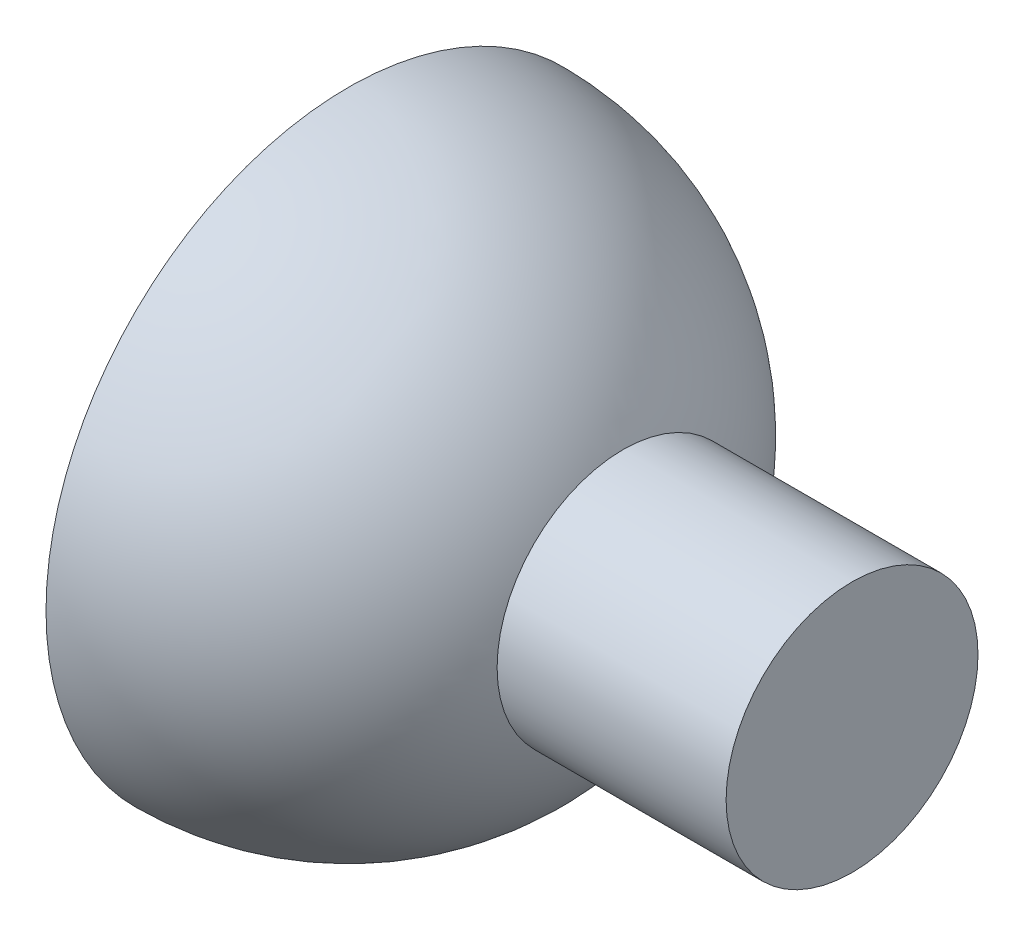
from build123d import *

# Parameters (mm, degrees)
BOSS_EXTRUDE2_START             = -15
SKETCH4_R                       = 5
BOSS_EXTRUDE2_DEPTH             = 5
BOSS_EXTRUDE2_DIRECTION_2_REACH = 37.785


with BuildPart() as part:
    # Sketch3 → Revolve-Thin2 (revolve)
    with BuildSketch(Plane.XY):
        with BuildLine():
            ThreePointArc((10, 0), (7.071067812, 7.071067812), (0, 10))
            Line((0, 10), (0, 12))
            ThreePointArc((0, 12), (8.485281374, 8.485281374), (12, 0))
            Line((12, 0), (10, 0))
        make_face()
    revolve(axis=Axis((0, 0, 0), (1, 0, 0)))

    # Sketch4 → Boss-Extrude2 (add)
    with BuildSketch(Plane.ZY.offset(BOSS_EXTRUDE2_START)):
        Circle(SKETCH4_R)
    extrude(amount=-BOSS_EXTRUDE2_DEPTH)

    # Sketch4 → Boss-Extrude2 direction 2 (add, up to next)
    with BuildSketch(Plane.ZY.offset(BOSS_EXTRUDE2_START), mode=Mode.PRIVATE) as boss_extrude2_direction_2_sk1:
        Circle(SKETCH4_R)
    boss_extrude2_direction_2_tool1 = extrude(boss_extrude2_direction_2_sk1.sketch, amount=BOSS_EXTRUDE2_DIRECTION_2_REACH, mode=Mode.PRIVATE) - part.part
    add(boss_extrude2_direction_2_tool1.solids().sort_by_distance((15, 0, 0))[0])


solid = part.part
